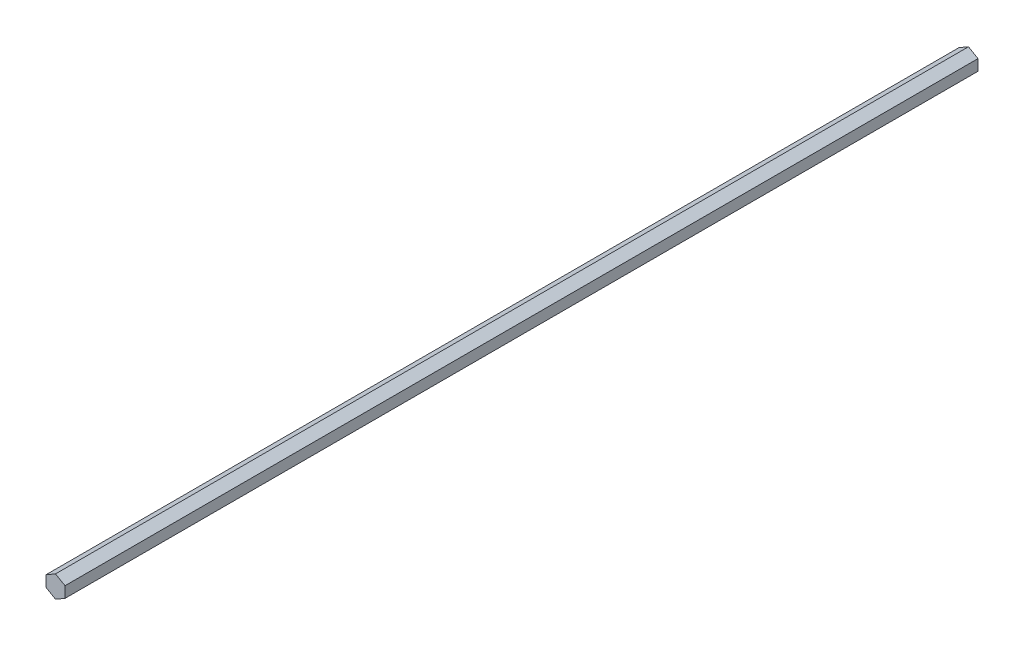
from build123d import *

# Parameters (mm, degrees)
BOSS_EXTRUDE1_DEPTH = 304.8


with BuildPart() as part:
    # Sketch3 → Boss-Extrude1 (new, symmetric)
    with BuildSketch(Plane.XY):
        Polygon((0, 7.332348419), (6.35, 3.666174209), (6.35, -3.666174209), (0, -7.332348419), (-6.35, -3.666174209), (-6.35, 3.666174209), align=None)
    extrude(amount=BOSS_EXTRUDE1_DEPTH, both=True)


solid = part.part
